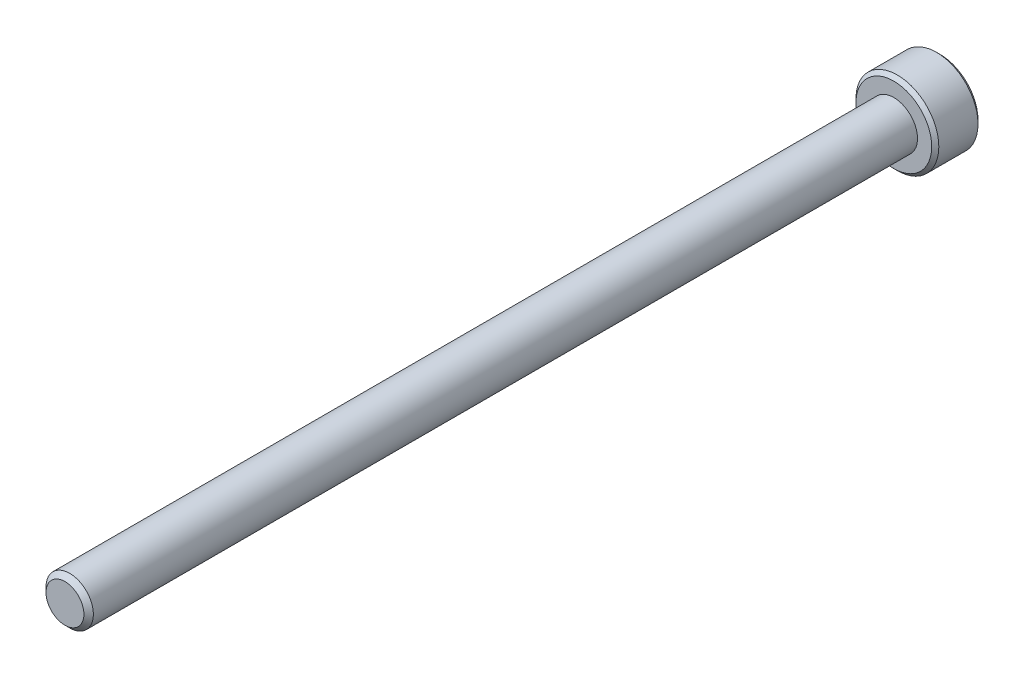
from build123d import *

# Parameters (mm, degrees)
SKETCH_1_R          = 3.5
EXTRUDE_1_DEPTH     = 3.91
SKETCH_2_R          = 2
EXTRUDE_2_DEPTH     = 70
CUT_EXTRUDE_1_DEPTH = 2
CHAMFER_1_SIZE      = 0.4
CHAMFER_2_SIZE      = 0.3


with BuildPart() as part:
    # 草图1 → 凸台-拉伸1 (new body)
    with BuildSketch(Plane.XY):
        Circle(SKETCH_1_R)
    extrude(amount=EXTRUDE_1_DEPTH)

    # 草图2 → 凸台-拉伸2 (add)
    with BuildSketch(Plane.XY.offset(3.91)):
        Circle(SKETCH_2_R)
    extrude(amount=EXTRUDE_2_DEPTH)

    # 草图3 → 切除-拉伸1 (cut)
    with BuildSketch(Plane(origin=(0, 0, 0), x_dir=(-1, 0, 0), z_dir=(0, 0, -1))):
        Polygon((0, 1.760918321), (-1.525, 0.880459161), (-1.525, -0.880459161), (0, -1.760918321), (1.525, -0.880459161), (1.525, 0.880459161), align=None)
    extrude(amount=-CUT_EXTRUDE_1_DEPTH, mode=Mode.SUBTRACT)

    # 倒角1
    chamfer_1_edges = [part.edges().sort_by_distance(p)[0] for p in [
        (-2, 0, 73.91),
    ]]
    chamfer(chamfer_1_edges, length=CHAMFER_1_SIZE)

    # 倒角2
    chamfer_2_edges = [part.edges().sort_by_distance(p)[0] for p in [
        (-3.5, 0, 0),
        (-3.5, 0, 3.91),
    ]]
    chamfer(chamfer_2_edges, length=CHAMFER_2_SIZE)


solid = part.part
